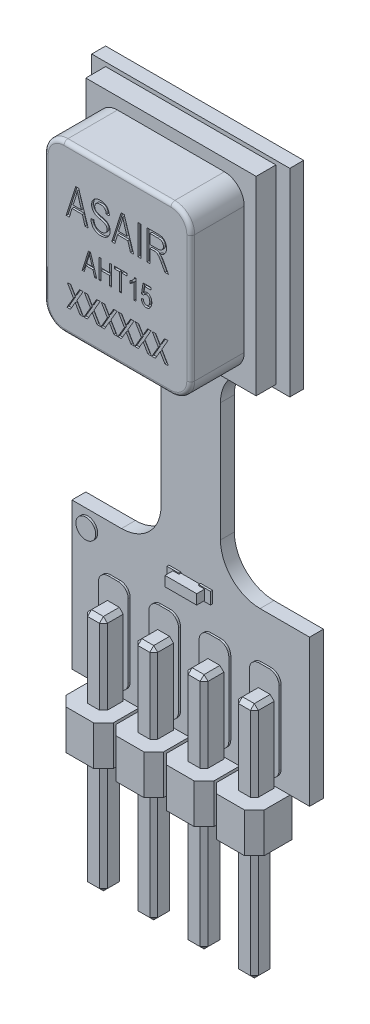
from build123d import *

# Parameters (mm, degrees)
SKETCH1_W                  = 5
SKETCH1_H                  = 5
BOSS_EXTRUDE1_DEPTH        = 0.35
FILLET1_R                  = 1
BOSS_EXTRUDE3_START        = -0.35
SKETCH6_W                  = 3.7
SKETCH6_H                  = 4.2
BOSS_EXTRUDE3_DEPTH        = 2.2
SKETCH3_W                  = 4.3
SKETCH3_H                  = 4.8
BOSS_EXTRUDE2_DEPTH        = 0.5
FILLET2_R                  = 0.5
FILLET3_R                  = 0.1
SKETCH7_R                  = 0.25
SKETCH7_W                  = 0.75
SKETCH7_H                  = 2.35
SKETCH7_W_2                = 0.3
SKETCH7_H_2                = 0.3
BOSS_EXTRUDE4_DEPTH        = 0.05
FILLET4_R                  = 0.25
SKETCH8_W                  = 0.8
SKETCH8_H                  = 0.25
BOSS_EXTRUDE5_DEPTH        = 0.25
SKETCH9_W                  = 1.2
SKETCH9_H                  = 1.2
BOSS_EXTRUDE6_DEPTH        = 1
CHAMFER1_SIZE              = 0.25
SKETCH10_W                 = 0.5
SKETCH10_H                 = 0.5
BOSS_EXTRUDE7_DEPTH        = 3
CHAMFER2_SIZE              = 0.1
LPATTERN1_COUNT            = 4
LPATTERN1_PITCH            = 1.27
CHAMFER1_OF_LPATTERN1_SIZE = 0.25
CHAMFER2_OF_LPATTERN1_SIZE = 0.1
SKETCH11_W                 = 0.077922078
SKETCH11_H                 = 0.75
CUT_EXTRUDE1_DEPTH         = 0.05


with BuildPart() as part:
    # Sketch1 → Boss-Extrude1 (new body)
    with BuildSketch(Plane.XY):
        Rectangle(SKETCH1_W, SKETCH1_H)
        Polygon((0.75, -2.5), (-0.75, -2.5), (-0.75, -7.5), (-3, -7.5), (-3, -11.2), (3, -11.2), (3, -7.5), (0.75, -7.5), align=None)
    extrude(amount=-BOSS_EXTRUDE1_DEPTH)

    # Fillet1
    fillet1_edges = [part.edges().sort_by_distance(p)[0] for p in [
        (0.75, -2.5, -0.175),
        (0.75, -7.5, -0.175),
        (-0.75, -7.5, -0.175),
        (-0.75, -2.5, -0.175),
    ]]
    fillet(fillet1_edges, radius=FILLET1_R)

    # Sketch6 → Boss-Extrude3 (add)
    with BuildSketch(Plane.XY.offset(BOSS_EXTRUDE3_START)):
        Rectangle(SKETCH6_W, SKETCH6_H)
    extrude(amount=BOSS_EXTRUDE3_DEPTH)

    # Sketch3 → Boss-Extrude2 (add)
    with BuildSketch(Plane.XY):
        Rectangle(SKETCH3_W, SKETCH3_H)
    extrude(amount=BOSS_EXTRUDE2_DEPTH)

    # Fillet2
    fillet2_edges = [part.edges().sort_by_distance(p)[0] for p in [
        (1.85, -2.1, 1.175),
        (1.85, 2.1, 1.175),
        (-1.85, 2.1, 1.175),
        (-1.85, -2.1, 1.175),
    ]]
    fillet(fillet2_edges, radius=FILLET2_R)

    # Fillet3
    fillet3_edges = [part.edges().sort_by_distance(p)[0] for p in [
        (0, 2.1, 1.85),
        (1.85, 0, 1.85),
        (-1.85, 0, 1.85),
        (0, -2.1, 1.85),
        (1.703553391, -1.953553391, 1.85),
        (-1.703553391, -1.953553391, 1.85),
        (-1.703553391, 1.953553391, 1.85),
        (1.703553391, 1.953553391, 1.85),
    ]]
    fillet(fillet3_edges, radius=FILLET3_R)

    # Sketch7 → Boss-Extrude4 (add)
    with BuildSketch(Plane.XY):
        with Locations((-2.6, -7.9)):
            Circle(SKETCH7_R)
        with Locations((-1.905, -9.825)):
            Rectangle(SKETCH7_W, SKETCH7_H)
        with Locations((-0.635, -9.825)):
            Rectangle(SKETCH7_W, SKETCH7_H)
        with Locations((0.635, -9.825)):
            Rectangle(SKETCH7_W, SKETCH7_H)
        with Locations((1.905, -9.825)):
            Rectangle(SKETCH7_W, SKETCH7_H)
        with Locations((-0.4, -7.85)):
            Rectangle(SKETCH7_W_2, SKETCH7_H_2)
        with Locations((0.4, -7.85)):
            Rectangle(SKETCH7_W_2, SKETCH7_H_2)
    extrude(amount=BOSS_EXTRUDE4_DEPTH)

    # Fillet4
    fillet4_edges = [part.edges().sort_by_distance(p)[0] for p in [
        (-2.28, -8.65, 0.025),
        (-2.28, -11, 0.025),
        (-1.53, -11, 0.025),
        (-1.53, -8.65, 0.025),
        (-1.01, -8.65, 0.025),
        (-1.01, -11, 0.025),
        (-0.26, -11, 0.025),
        (-0.26, -8.65, 0.025),
        (0.26, -8.65, 0.025),
        (0.26, -11, 0.025),
        (1.01, -11, 0.025),
        (1.01, -8.65, 0.025),
        (1.53, -8.65, 0.025),
        (1.53, -11, 0.025),
        (2.28, -11, 0.025),
        (2.28, -8.65, 0.025),
    ]]
    fillet(fillet4_edges, radius=FILLET4_R)

    # Sketch8 → Boss-Extrude5 (add)
    with BuildSketch(Plane.XY):
        with Locations((0, -7.85)):
            Rectangle(SKETCH8_W, SKETCH8_H)
    extrude(amount=BOSS_EXTRUDE5_DEPTH)

    # Sketch9 → Boss-Extrude6 (add)
    with BuildSketch(Plane.XZ.offset(11.2)):
        with Locations((-1.905, 0.3)):
            Rectangle(SKETCH9_W, SKETCH9_H)
    boss_extrude6 = extrude(amount=BOSS_EXTRUDE6_DEPTH)

    # Chamfer1
    chamfer1_edges = [part.edges().sort_by_distance(p)[0] for p in [
        (-1.305, -11.7, -0.3),
        (-1.305, -11.7, 0.9),
        (-2.505, -11.7, 0.9),
        (-2.505, -11.7, -0.3),
    ]]
    chamfer(chamfer1_edges, length=CHAMFER1_SIZE)

    # Sketch10 → Boss-Extrude7 (add, symmetric)
    with BuildSketch(Plane.XZ.offset(12.2)):
        with Locations((-1.905, 0.3)):
            Rectangle(SKETCH10_W, SKETCH10_H)
    boss_extrude7 = extrude(amount=BOSS_EXTRUDE7_DEPTH, both=True)

    # Chamfer2
    chamfer2_edges = [part.edges().sort_by_distance(p)[0] for p in [
        (-2.155, -9.2, 0.3),
        (-1.655, -9.2, 0.3),
        (-2.155, -10.2, 0.55),
        (-1.905, -9.2, 0.55),
        (-1.655, -10.2, 0.55),
        (-1.905, -15.2, 0.05),
        (-2.155, -13.7, 0.05),
        (-2.155, -15.2, 0.3),
        (-2.155, -13.7, 0.55),
        (-1.905, -15.2, 0.55),
        (-1.655, -13.7, 0.05),
        (-1.655, -15.2, 0.3),
        (-1.655, -13.7, 0.55),
    ]]
    chamfer(chamfer2_edges, length=CHAMFER2_SIZE)

    # LPattern1: Boss-Extrude6, Boss-Extrude7 ×4
    with Locations(*[(i * LPATTERN1_PITCH, 0, 0) for i in range(1, LPATTERN1_COUNT)]):
        add(boss_extrude6)
        add(boss_extrude7)

    # Chamfer1 of LPattern1
    chamfer1_of_lpattern1_edges = [part.edges().sort_by_distance(p)[0] for p in [
        (-0.035, -11.7, -0.3),
        (-0.035, -11.7, 0.9),
        (-1.235, -11.7, 0.9),
        (-1.235, -11.7, -0.3),
        (1.235, -11.7, -0.3),
        (1.235, -11.7, 0.9),
        (0.035, -11.7, 0.9),
        (0.035, -11.7, -0.3),
        (2.505, -11.7, -0.3),
        (2.505, -11.7, 0.9),
        (1.305, -11.7, 0.9),
        (1.305, -11.7, -0.3),
    ]]
    chamfer(chamfer1_of_lpattern1_edges, length=CHAMFER1_OF_LPATTERN1_SIZE)

    # Chamfer2 of LPattern1
    chamfer2_of_lpattern1_edges = [part.edges().sort_by_distance(p)[0] for p in [
        (-0.885, -9.2, 0.3),
        (-0.385, -9.2, 0.3),
        (-0.885, -10.2, 0.55),
        (-0.635, -9.2, 0.55),
        (-0.385, -10.2, 0.55),
        (-0.635, -15.2, 0.05),
        (-0.885, -13.7, 0.05),
        (-0.885, -15.2, 0.3),
        (-0.885, -13.7, 0.55),
        (-0.635, -15.2, 0.55),
        (-0.385, -13.7, 0.05),
        (-0.385, -15.2, 0.3),
        (-0.385, -13.7, 0.55),
        (0.385, -9.2, 0.3),
        (0.885, -9.2, 0.3),
        (0.385, -10.2, 0.55),
        (0.635, -9.2, 0.55),
        (0.885, -10.2, 0.55),
        (0.635, -15.2, 0.05),
        (0.385, -13.7, 0.05),
        (0.385, -15.2, 0.3),
        (0.385, -13.7, 0.55),
        (0.635, -15.2, 0.55),
        (0.885, -13.7, 0.05),
        (0.885, -15.2, 0.3),
        (0.885, -13.7, 0.55),
        (1.655, -9.2, 0.3),
        (2.155, -9.2, 0.3),
        (1.655, -10.2, 0.55),
        (1.905, -9.2, 0.55),
        (2.155, -10.2, 0.55),
        (1.905, -15.2, 0.05),
        (1.655, -13.7, 0.05),
        (1.655, -15.2, 0.3),
        (1.655, -13.7, 0.55),
        (1.905, -15.2, 0.55),
        (2.155, -13.7, 0.05),
        (2.155, -15.2, 0.3),
        (2.155, -13.7, 0.55),
    ]]
    chamfer(chamfer2_of_lpattern1_edges, length=CHAMFER2_OF_LPATTERN1_SIZE)

    # Sketch11 → Cut-Extrude1 (cut)
    # profile 1 of 16: a face of its own
    with BuildSketch(Plane.XY.offset(1.85)):
        Polygon((-1.295454545, 0.5), (-1.055905032, 1.25), (-0.979961445, 1.25), (-0.74025974, 0.5), (-0.821225649, 0.5), (-0.886820211, 0.724025974), (-1.148894075, 0.724025974), (-1.214336445, 0.5), align=None)
        with BuildLine():
            Line((-1.123325893, 0.811688312), (-0.912540584, 0.811688312))
            Line((-0.912540584, 0.811688312), (-0.975243506, 1.017755682))
            add(Edge.make_bspline(
                [(-0.975243506, 1.017755682), (-0.977589239, 1.025463121), (-0.982168938, 1.040510774), (-0.988654211, 1.062545168), (-0.994878599, 1.083444379), (-1.000195426, 1.10335419), (-1.005482376, 1.122015555), (-1.01004201, 1.139636144), (-1.014135042, 1.156128508), (-1.016649337, 1.166799599), (-1.017857143, 1.171925731)],
                knots=[0, 0, 0, 0, 1.20859176, 2.359599242, 3.445754582, 4.479676267, 5.450859039, 6.355343929, 7.209947359, 8, 8, 8, 8], degree=3))
            add(Edge.make_bspline(
                [(-1.017857143, 1.171925731), (-1.020049832, 1.159985574), (-1.024432297, 1.136121124), (-1.032647056, 1.100570601), (-1.041786224, 1.06508423), (-1.049060666, 1.041672614), (-1.05270901, 1.029931006)],
                knots=[0, 0, 0, 0, 0.995500629, 1.989678841, 2.991765375, 4, 4, 4, 4], degree=3))
            Line((-1.05270901, 1.029931006), (-1.123325893, 0.811688312))
        make_face(mode=Mode.SUBTRACT)
    # profile 2 of 16: a face of its own
    with BuildSketch(Plane.XY.offset(1.85)):
        with BuildLine():
            Line((-0.672077922, 0.743506494), (-0.594155844, 0.753246753))
            add(Edge.make_bspline(
                [(-0.594155844, 0.753246753), (-0.593021253, 0.743326643), (-0.590869493, 0.724513076), (-0.584976182, 0.698166299), (-0.57709386, 0.675276365), (-0.567355767, 0.655382138), (-0.55487651, 0.638518567), (-0.540621981, 0.623352604), (-0.523832192, 0.610121597), (-0.505037623, 0.598570848), (-0.484351169, 0.589248453), (-0.462157002, 0.582806942), (-0.438768418, 0.578684173), (-0.422755193, 0.578179863), (-0.414569805, 0.577922078)],
                knots=[0, 0, 0, 0, 1.28056062, 2.428593037, 3.455857635, 4.381585452, 5.257863862, 6.137303782, 7.045121912, 7.991827123, 8.962072888, 9.946560163, 10.950355038, 12, 12, 12, 12], degree=3))
            add(Edge.make_bspline(
                [(-0.414569805, 0.577922078), (-0.408730973, 0.578040733), (-0.397383678, 0.57827133), (-0.380860703, 0.58000575), (-0.365297764, 0.582618449), (-0.35084121, 0.586683045), (-0.337222291, 0.591436168), (-0.324824398, 0.597773005), (-0.31322263, 0.604934546), (-0.302753935, 0.613272481), (-0.293522843, 0.622644048), (-0.285155497, 0.632479486), (-0.27835221, 0.64324687), (-0.272615478, 0.654521653), (-0.268408513, 0.6665814), (-0.265145476, 0.679185969), (-0.263326342, 0.692570896), (-0.263101895, 0.701699364), (-0.262987013, 0.706371753)],
                knots=[0, 0, 0, 0, 1.25000475, 2.42928239, 3.554432982, 4.624373226, 5.641561959, 6.637472043, 7.59895824, 8.557494333, 9.494616268, 10.412591127, 11.316575992, 12.215324116, 13.115580924, 14.045624415, 14.999656403, 16, 16, 16, 16], degree=3))
            add(Edge.make_bspline(
                [(-0.262987013, 0.706371753), (-0.263154527, 0.711760649), (-0.263480803, 0.722256908), (-0.266257952, 0.737536678), (-0.270993128, 0.751696561), (-0.2774394, 0.764844953), (-0.285764905, 0.776876262), (-0.296046641, 0.787731618), (-0.308264036, 0.797327201), (-0.319921777, 0.804604338), (-0.331183347, 0.809904711), (-0.341823047, 0.814473566), (-0.354636629, 0.81929295), (-0.369603332, 0.824480133), (-0.386727896, 0.82988406), (-0.406019757, 0.83567419), (-0.427411483, 0.84192643), (-0.442465169, 0.846055646), (-0.450334821, 0.848214286)],
                knots=[0, 0, 0, 0, 1.005239862, 1.957963033, 2.886140254, 3.783827184, 4.682063204, 5.60636897, 6.563082868, 7.574767638, 8.163399764, 8.884479363, 9.735568196, 10.717712603, 11.840607427, 13.08667948, 14.476996158, 16, 16, 16, 16], degree=3))
            add(Edge.make_bspline(
                [(-0.450334821, 0.848214286), (-0.457397304, 0.850206966), (-0.471007797, 0.854047169), (-0.490525608, 0.860192988), (-0.508504276, 0.866158627), (-0.524832982, 0.872523306), (-0.539716795, 0.878567894), (-0.552862705, 0.885054644), (-0.564472032, 0.891406237), (-0.577823291, 0.899832412), (-0.592406105, 0.91161721), (-0.607861866, 0.927364467), (-0.621363473, 0.94480139), (-0.632628142, 0.963926455), (-0.641764315, 0.984504832), (-0.647814009, 1.006686833), (-0.652033439, 1.030024512), (-0.652407051, 1.046094272), (-0.652597403, 1.054281656)],
                knots=[0, 0, 0, 0, 1.113815205, 2.146493548, 3.105946624, 3.988323839, 4.806360381, 5.543364066, 6.212027532, 6.814445107, 7.937696897, 9.048553401, 10.157540001, 11.276136463, 12.410655589, 13.563606105, 14.758681343, 16, 16, 16, 16], degree=3))
            add(Edge.make_bspline(
                [(-0.652597403, 1.054281656), (-0.652429436, 1.061646785), (-0.652099247, 1.076125144), (-0.649280491, 1.097316089), (-0.644812561, 1.117549158), (-0.638145523, 1.13660825), (-0.629988706, 1.154764805), (-0.619658902, 1.171654392), (-0.607714195, 1.187681756), (-0.593884976, 1.20246595), (-0.578653209, 1.216024606), (-0.561844648, 1.227678337), (-0.543814114, 1.237553722), (-0.524557836, 1.245897531), (-0.503898781, 1.252067296), (-0.482033328, 1.256410162), (-0.458932281, 1.259264), (-0.443089143, 1.259578803), (-0.434963474, 1.25974026)],
                knots=[0, 0, 0, 0, 1.048547399, 2.061232895, 3.039277619, 3.994368589, 4.931972946, 5.868741773, 6.808014961, 7.774272834, 8.746911737, 9.706990873, 10.680354074, 11.670809819, 12.690200298, 13.744432806, 14.843158913, 16, 16, 16, 16], degree=3))
            add(Edge.make_bspline(
                [(-0.434963474, 1.25974026), (-0.423885487, 1.259430988), (-0.402269424, 1.258827519), (-0.370913883, 1.253780462), (-0.341713703, 1.245230123), (-0.314779892, 1.233332177), (-0.290322736, 1.218311838), (-0.268761719, 1.200078017), (-0.249951717, 1.17903851), (-0.234303594, 1.154966941), (-0.221638585, 1.128413671), (-0.212364552, 1.099496203), (-0.206318448, 1.068369803), (-0.205147418, 1.046801422), (-0.204545455, 1.035714286)],
                knots=[0, 0, 0, 0, 1.10297814, 2.152200164, 3.153123011, 4.125894755, 5.076644034, 6.001845166, 6.928824672, 7.877651763, 8.851800581, 9.850539915, 10.895078977, 12, 12, 12, 12], degree=3))
            Line((-0.204545455, 1.035714286), (-0.282467532, 1.025974026))
            add(Edge.make_bspline(
                [(-0.282467532, 1.025974026), (-0.283039152, 1.031971602), (-0.284153853, 1.043667338), (-0.287233789, 1.060492248), (-0.291170336, 1.076179297), (-0.296105759, 1.090642715), (-0.30230742, 1.103828938), (-0.309212202, 1.11588795), (-0.317254755, 1.126695147), (-0.326227792, 1.136309853), (-0.336229808, 1.144729573), (-0.347126921, 1.152109206), (-0.359011779, 1.15835996), (-0.371905515, 1.163342021), (-0.385640319, 1.167350737), (-0.40038334, 1.170016813), (-0.416051806, 1.17172009), (-0.426841934, 1.17195661), (-0.432376218, 1.172077922)],
                knots=[0, 0, 0, 0, 1.225165016, 2.389166377, 3.475498799, 4.513395989, 5.492249234, 6.435697439, 7.335638185, 8.226419293, 9.105162265, 9.989643781, 10.899061877, 11.830466535, 12.797276613, 13.805291738, 14.874328703, 16, 16, 16, 16], degree=3))
            add(Edge.make_bspline(
                [(-0.432376218, 1.172077922), (-0.438013282, 1.17202964), (-0.448908961, 1.171936317), (-0.464755957, 1.170095433), (-0.479595113, 1.167664226), (-0.493446571, 1.163961969), (-0.506190965, 1.159289629), (-0.518005599, 1.153584737), (-0.528730018, 1.146794874), (-0.538422295, 1.138965965), (-0.546910396, 1.130260581), (-0.554377571, 1.121002323), (-0.560763382, 1.111155399), (-0.565740487, 1.100571241), (-0.569715308, 1.08940723), (-0.572636554, 1.077640869), (-0.574300294, 1.065236268), (-0.574548652, 1.056772321), (-0.574675325, 1.052455357)],
                knots=[0, 0, 0, 0, 1.28677749, 2.487165856, 3.639785246, 4.719183444, 5.756778416, 6.736320351, 7.710431992, 8.649732596, 9.575714218, 10.482424581, 11.363216052, 12.249555033, 13.147559346, 14.066626488, 15.013899474, 16, 16, 16, 16], degree=3))
            add(Edge.make_bspline(
                [(-0.574675325, 1.052455357), (-0.574417131, 1.044717166), (-0.573926187, 1.030003354), (-0.569336367, 1.009275799), (-0.561696608, 0.99110791), (-0.553948192, 0.98119165), (-0.550172484, 0.976359578)],
                knots=[0, 0, 0, 0, 1.135097977, 2.158336086, 3.102579849, 4, 4, 4, 4], degree=3))
            add(Edge.make_bspline(
                [(-0.550172484, 0.976359578), (-0.547854185, 0.974047811), (-0.54281896, 0.969026773), (-0.533121289, 0.962700796), (-0.52157773, 0.956045658), (-0.507588488, 0.950009679), (-0.491663402, 0.943680784), (-0.47340039, 0.937878398), (-0.453031081, 0.931874847), (-0.438581344, 0.928309681), (-0.431006494, 0.926440747)],
                knots=[0, 0, 0, 0, 0.600125557, 1.303441474, 2.117395318, 3.047759802, 4.098473224, 5.265768101, 6.566659033, 8, 8, 8, 8], degree=3))
            add(Edge.make_bspline(
                [(-0.431006494, 0.926440747), (-0.423542673, 0.924640107), (-0.409200953, 0.921180182), (-0.388633793, 0.915783972), (-0.369739186, 0.910796092), (-0.352545197, 0.906019104), (-0.337171214, 0.901076451), (-0.323481458, 0.89649405), (-0.311398081, 0.892401966), (-0.3041125, 0.889248115), (-0.300730519, 0.887784091)],
                knots=[0, 0, 0, 0, 1.354590389, 2.602843464, 3.751324185, 4.802492375, 5.750771121, 6.599881396, 7.350062303, 8, 8, 8, 8], degree=3))
            add(Edge.make_bspline(
                [(-0.300730519, 0.887784091), (-0.291606853, 0.88337113), (-0.273917691, 0.874815186), (-0.250337199, 0.858044127), (-0.230141211, 0.838987559), (-0.213707348, 0.817222895), (-0.200736929, 0.793229601), (-0.191651589, 0.766912787), (-0.18602906, 0.738468545), (-0.185392271, 0.71877693), (-0.185064935, 0.708654627)],
                knots=[0, 0, 0, 0, 1.070280572, 2.075083192, 3.046573603, 3.996247495, 4.946860593, 5.919165523, 6.930365132, 8, 8, 8, 8], degree=3))
            add(Edge.make_bspline(
                [(-0.185064935, 0.708654627), (-0.185395943, 0.698482016), (-0.186049983, 0.678381873), (-0.191854958, 0.64898106), (-0.201339692, 0.620962986), (-0.214606263, 0.594782475), (-0.230841666, 0.570678714), (-0.249947207, 0.549296897), (-0.272008134, 0.531159972), (-0.296714771, 0.51618377), (-0.324068876, 0.504300907), (-0.354188067, 0.496293676), (-0.386844248, 0.491109696), (-0.40952622, 0.490549627), (-0.421266234, 0.49025974)],
                knots=[0, 0, 0, 0, 1.011281659, 1.998199493, 2.968653118, 3.946038549, 4.909179922, 5.852720419, 6.788493457, 7.73981833, 8.718701351, 9.744837575, 10.832745308, 12, 12, 12, 12], degree=3))
            add(Edge.make_bspline(
                [(-0.421266234, 0.49025974), (-0.430508846, 0.490453548), (-0.448544595, 0.49083174), (-0.474829116, 0.494088258), (-0.499650434, 0.499386796), (-0.523063834, 0.506853851), (-0.545104578, 0.51647897), (-0.565748525, 0.528218474), (-0.584893208, 0.542153956), (-0.602387884, 0.55818777), (-0.618208996, 0.575977521), (-0.632149902, 0.595374664), (-0.643942283, 0.616425845), (-0.653599289, 0.638959404), (-0.661453682, 0.66293495), (-0.667197171, 0.688406538), (-0.670868562, 0.715453814), (-0.671668461, 0.734008499), (-0.672077922, 0.743506494)],
                knots=[0, 0, 0, 0, 1.104995383, 2.156254069, 3.161771291, 4.136451373, 5.090038804, 6.032932257, 6.970972664, 7.915738022, 8.865457713, 9.813334699, 10.766787024, 11.745048075, 12.740780621, 13.779854267, 14.863525297, 16, 16, 16, 16], degree=3))
        make_face()
    # profile 3 of 16: a face of its own
    with BuildSketch(Plane.XY.offset(1.85)):
        Polygon((-0.146103896, 0.5), (0.093445617, 1.25), (0.169389205, 1.25), (0.409090909, 0.5), (0.328125, 0.5), (0.262530438, 0.724025974), (0.000456575, 0.724025974), (-0.064985795, 0.5), align=None)
        with BuildLine():
            Line((0.026024756, 0.811688312), (0.236810065, 0.811688312))
            Line((0.236810065, 0.811688312), (0.174107143, 1.017755682))
            add(Edge.make_bspline(
                [(0.174107143, 1.017755682), (0.171761411, 1.025463121), (0.167181711, 1.040510774), (0.160696438, 1.062545168), (0.15447205, 1.083444379), (0.149155224, 1.10335419), (0.143868274, 1.122015555), (0.139308639, 1.139636144), (0.135215607, 1.156128508), (0.132701312, 1.166799599), (0.131493506, 1.171925731)],
                knots=[0, 0, 0, 0, 1.20859176, 2.359599242, 3.445754582, 4.479676267, 5.450859039, 6.355343929, 7.209947359, 8, 8, 8, 8], degree=3))
            add(Edge.make_bspline(
                [(0.131493506, 1.171925731), (0.129300817, 1.159985574), (0.124918352, 1.136121124), (0.116703593, 1.100570601), (0.107564425, 1.06508423), (0.100289984, 1.041672614), (0.09664164, 1.029931006)],
                knots=[0, 0, 0, 0, 0.995500629, 1.989678841, 2.991765375, 4, 4, 4, 4], degree=3))
            Line((0.09664164, 1.029931006), (0.026024756, 0.811688312))
        make_face(mode=Mode.SUBTRACT)
    # profile 4 of 16: a face of its own
    with BuildSketch(Plane.XY.offset(1.85)):
        with Locations((0.555194805, 0.875)):
            Rectangle(SKETCH11_W, SKETCH11_H)
    # profile 5 of 16: a face of its own
    with BuildSketch(Plane.XY.offset(1.85)):
        with BuildLine():
            Line((0.74025974, 0.5), (0.74025974, 1.25))
            Line((0.74025974, 1.25), (1.015726461, 1.25))
            add(Edge.make_bspline(
                [(1.015726461, 1.25), (1.022678173, 1.249959985), (1.036133927, 1.249882532), (1.055626537, 1.248768328), (1.073751616, 1.247118954), (1.090485019, 1.244925929), (1.105729059, 1.241885529), (1.11954419, 1.238197306), (1.132042805, 1.234080477), (1.146715705, 1.227289732), (1.163455626, 1.216756612), (1.181509618, 1.200708873), (1.197323443, 1.180835818), (1.211395402, 1.158002463), (1.22295173, 1.132366012), (1.231137594, 1.104407904), (1.236079239, 1.074495475), (1.236696324, 1.053895121), (1.237012987, 1.043323864)],
                knots=[0, 0, 0, 0, 0.957775898, 1.853873864, 2.6892683, 3.465319774, 4.178195347, 4.829309051, 5.435011313, 5.988660553, 7.053440284, 8.147710094, 9.30058322, 10.540256924, 11.835580405, 13.162637032, 14.543981594, 16, 16, 16, 16], degree=3))
            add(Edge.make_bspline(
                [(1.237012987, 1.043323864), (1.236847419, 1.036318562), (1.236524012, 1.022635018), (1.234564899, 1.002579413), (1.231160413, 0.983555617), (1.225953836, 0.965612856), (1.219915483, 0.948528163), (1.211986349, 0.93260102), (1.202889179, 0.917625729), (1.192315685, 0.90372132), (1.180488843, 0.890918798), (1.167215678, 0.879419402), (1.152754274, 0.869059846), (1.136991872, 0.859931092), (1.120026022, 0.85191629), (1.101656044, 0.845520818), (1.082168237, 0.839920136), (1.068612802, 0.837351229), (1.061688312, 0.836038961)],
                knots=[0, 0, 0, 0, 1.121977975, 2.191573688, 3.224240956, 4.211948119, 5.180998842, 6.122125515, 7.055751929, 7.983633331, 8.914994346, 9.842128418, 10.791356962, 11.759862547, 12.75578979, 13.791489111, 14.871831714, 16, 16, 16, 16], degree=3))
            add(Edge.make_bspline(
                [(1.061688312, 0.836038961), (1.06679929, 0.833211181), (1.076528608, 0.827828185), (1.089843535, 0.819143236), (1.101222669, 0.810401407), (1.107655398, 0.804039869), (1.110693994, 0.801034903)],
                knots=[0, 0, 0, 0, 1.158843086, 2.205987482, 3.152571606, 4, 4, 4, 4], degree=3))
            add(Edge.make_bspline(
                [(1.110693994, 0.801034903), (1.116771601, 0.793698986), (1.128995159, 0.778944661), (1.145751711, 0.755405986), (1.161802281, 0.730919179), (1.171227932, 0.713693973), (1.175984172, 0.705002029)],
                knots=[0, 0, 0, 0, 0.982253192, 1.975551771, 2.978451105, 4, 4, 4, 4], degree=3))
            Line((1.175984172, 0.705002029), (1.285714286, 0.5))
            Line((1.285714286, 0.5), (1.197138799, 0.5))
            Line((1.197138799, 0.5), (1.110541802, 0.660409903))
            add(Edge.make_bspline(
                [(1.110541802, 0.660409903), (1.106507721, 0.667931312), (1.098791488, 0.682317972), (1.087339797, 0.702744908), (1.076694648, 0.721166978), (1.066874019, 0.737602149), (1.057732372, 0.751876061), (1.049521842, 0.764184857), (1.042002523, 0.774388366), (1.033003087, 0.784901062), (1.022542706, 0.795798546), (1.010107856, 0.806743036), (0.997687448, 0.815227427), (0.985041771, 0.821688565), (0.971121597, 0.825944972), (0.9554363, 0.829130947), (0.937284267, 0.830863876), (0.924414891, 0.831062878), (0.917562906, 0.831168831)],
                knots=[0, 0, 0, 0, 1.483643366, 2.83785556, 4.070616892, 5.1822306, 6.165666296, 7.016844219, 7.754091418, 8.367230408, 9.421242841, 10.377779407, 11.241203819, 12.029974219, 12.835959019, 13.762973995, 14.808950166, 16, 16, 16, 16], degree=3))
            Line((0.917562906, 0.831168831), (0.818181818, 0.831168831))
            Line((0.818181818, 0.831168831), (0.818181818, 0.5))
            Line((0.818181818, 0.5), (0.74025974, 0.5))
        make_face()
        with BuildLine():
            Line((0.818181818, 0.918831169), (1.00096388, 0.918831169))
            add(Edge.make_bspline(
                [(1.00096388, 0.918831169), (1.010353908, 0.919014087), (1.027951738, 0.919356895), (1.052571097, 0.921633632), (1.073584425, 0.925753667), (1.091384232, 0.931754311), (1.106562359, 0.939705368), (1.119776908, 0.949551505), (1.131367806, 0.961310629), (1.141227104, 0.974912206), (1.14937905, 0.990059202), (1.154880955, 1.006710106), (1.158615428, 1.024387569), (1.158929835, 1.036607083), (1.159090909, 1.042867289)],
                knots=[0, 0, 0, 0, 1.47306528, 2.760668081, 3.873497699, 4.82484281, 5.696997418, 6.550136397, 7.399890849, 8.276969651, 9.17766846, 10.086208714, 11.019541422, 12, 12, 12, 12], degree=3))
            add(Edge.make_bspline(
                [(1.159090909, 1.042867289), (1.158950231, 1.047385257), (1.158675974, 1.056193156), (1.157232995, 1.069060653), (1.154416724, 1.081169319), (1.15070083, 1.092584221), (1.145705026, 1.103201071), (1.139871108, 1.113187459), (1.132523962, 1.122132805), (1.124528553, 1.130601376), (1.115275646, 1.138119533), (1.104942602, 1.144633848), (1.093531504, 1.15010599), (1.081151908, 1.154798126), (1.067552555, 1.157919172), (1.05305216, 1.160622331), (1.037470469, 1.162120993), (1.026737877, 1.162263963), (1.021205357, 1.162337662)],
                knots=[0, 0, 0, 0, 1.045235731, 2.037714497, 2.988326782, 3.915852726, 4.808207886, 5.697550021, 6.58254782, 7.478674216, 8.387536059, 9.331464042, 10.296946822, 11.310355404, 12.385965615, 13.518246496, 14.720686494, 16, 16, 16, 16], degree=3))
            Line((1.021205357, 1.162337662), (0.818181818, 1.162337662))
            Line((0.818181818, 1.162337662), (0.818181818, 0.918831169))
        make_face(mode=Mode.SUBTRACT)
    # profile 6 of 16: a face of its own
    with BuildSketch(Plane.XY.offset(1.85)):
        Polygon((-0.892857143, -0.5), (-0.733157468, 0), (-0.682528409, 0), (-0.522727273, -0.5), (-0.576704545, -0.5), (-0.620434253, -0.350649351), (-0.795150162, -0.350649351), (-0.838778409, -0.5), align=None)
        with BuildLine():
            Line((-0.778104708, -0.292207792), (-0.637581169, -0.292207792))
            Line((-0.637581169, -0.292207792), (-0.679383117, -0.154829545))
            add(Edge.make_bspline(
                [(-0.679383117, -0.154829545), (-0.680946938, -0.149691252), (-0.684000071, -0.139659484), (-0.688323587, -0.124969888), (-0.692473179, -0.111037081), (-0.69601773, -0.097763873), (-0.699542363, -0.085322963), (-0.702582119, -0.073575904), (-0.705310807, -0.062580994), (-0.706987004, -0.055466934), (-0.707792208, -0.052049513)],
                knots=[0, 0, 0, 0, 1.20859176, 2.359599242, 3.445754582, 4.479676267, 5.450859039, 6.355343929, 7.209947359, 8, 8, 8, 8], degree=3))
            add(Edge.make_bspline(
                [(-0.707792208, -0.052049513), (-0.709254001, -0.060009617), (-0.712175644, -0.075919251), (-0.71765215, -0.0996196), (-0.723744929, -0.12327718), (-0.728594556, -0.138884924), (-0.731026786, -0.146712662)],
                knots=[0, 0, 0, 0, 0.995500629, 1.989678841, 2.991765375, 4, 4, 4, 4], degree=3))
            Line((-0.731026786, -0.146712662), (-0.778104708, -0.292207792))
        make_face(mode=Mode.SUBTRACT)
    # profile 7 of 16: a face of its own
    with BuildSketch(Plane.XY.offset(1.85)):
        Polygon((-0.464285714, -0.5), (-0.464285714, 0), (-0.412337662, 0), (-0.412337662, -0.207792208), (-0.198051948, -0.207792208), (-0.198051948, 0), (-0.146103896, 0), (-0.146103896, -0.5), (-0.198051948, -0.5), (-0.198051948, -0.266233766), (-0.412337662, -0.266233766), (-0.412337662, -0.5), align=None)
    # profile 8 of 16: a face of its own
    with BuildSketch(Plane.XY.offset(1.85)):
        Polygon((0.055194805, -0.5), (0.055194805, -0.058441558), (-0.081168831, -0.058441558), (-0.081168831, 0), (0.243506494, 0), (0.243506494, -0.058441558), (0.107142857, -0.058441558), (0.107142857, -0.5), align=None)
    # profile 9 of 16: a face of its own
    with BuildSketch(Plane.XY.offset(1.85)):
        with BuildLine():
            Line((0.470779221, -0.5), (0.418831169, -0.5))
            Line((0.418831169, -0.5), (0.418831169, -0.103896104))
            add(Edge.make_bspline(
                [(0.418831169, -0.103896104), (0.415640849, -0.107568435), (0.409028915, -0.115179338), (0.397550937, -0.126003103), (0.384759999, -0.137164613), (0.370598731, -0.14799522), (0.356169527, -0.15836919), (0.341918006, -0.167493276), (0.32837831, -0.175431919), (0.319295085, -0.179746938), (0.314935065, -0.181818182)],
                knots=[0, 0, 0, 0, 0.892555828, 1.849821039, 2.893015883, 4.008277588, 5.121255548, 6.154629642, 7.114207698, 8, 8, 8, 8], degree=3))
            Line((0.314935065, -0.181818182), (0.314935065, -0.123376623))
            add(Edge.make_bspline(
                [(0.314935065, -0.123376623), (0.321941968, -0.119159602), (0.335895777, -0.110761669), (0.355446888, -0.096213738), (0.373916571, -0.080511637), (0.39075277, -0.063490845), (0.405827737, -0.045944956), (0.418766928, -0.028434138), (0.429376245, -0.01114444), (0.434580455, 0.000748878), (0.437094156, 0.006493506)],
                knots=[0, 0, 0, 0, 1.082272232, 2.155277244, 3.222407096, 4.289527553, 5.32168536, 6.282742408, 7.170542132, 8, 8, 8, 8], degree=3))
            Line((0.437094156, 0.006493506), (0.470779221, 0.006493506))
            Line((0.470779221, 0.006493506), (0.470779221, -0.5))
        make_face()
    # profile 10 of 16: a face of its own
    with BuildSketch(Plane.XY.offset(1.85)):
        with BuildLine():
            Line((0.600649351, -0.363636364), (0.652597403, -0.357142857))
            add(Edge.make_bspline(
                [(0.652597403, -0.357142857), (0.653124674, -0.361107893), (0.654152235, -0.368835059), (0.656440585, -0.379958681), (0.658964616, -0.390381707), (0.662334675, -0.399899376), (0.665753532, -0.408817572), (0.669979958, -0.416807998), (0.674503732, -0.424106942), (0.679644145, -0.430476597), (0.684982375, -0.436207903), (0.690668802, -0.441057087), (0.696554576, -0.445186581), (0.702602592, -0.44865939), (0.708939017, -0.451328145), (0.715492226, -0.453134494), (0.722226301, -0.454297449), (0.726794504, -0.454462295), (0.729099026, -0.454545455)],
                knots=[0, 0, 0, 0, 1.411223046, 2.750228965, 4.006672634, 5.191927097, 6.311278306, 7.373684419, 8.377051755, 9.337097037, 10.257438676, 11.13782359, 11.969011532, 12.792190119, 13.594685164, 14.388253401, 15.186922146, 16, 16, 16, 16], degree=3))
            add(Edge.make_bspline(
                [(0.729099026, -0.454545455), (0.731980974, -0.454451232), (0.737684411, -0.454264765), (0.746065912, -0.452674169), (0.75417558, -0.450163487), (0.761888655, -0.446423405), (0.769363875, -0.441840659), (0.776529748, -0.436205598), (0.783274127, -0.429455981), (0.789772763, -0.42186291), (0.795785718, -0.413411884), (0.800808045, -0.403980073), (0.805175174, -0.393900493), (0.80888709, -0.383104698), (0.811568497, -0.371501289), (0.813451363, -0.359186407), (0.814727481, -0.346143901), (0.814864575, -0.337192036), (0.814935065, -0.332589286)],
                knots=[0, 0, 0, 0, 0.833557162, 1.649627401, 2.46080936, 3.284070299, 4.12358479, 4.995082037, 5.915776015, 6.88098611, 7.885890802, 8.910954604, 9.967600199, 11.063514457, 12.210406555, 13.409466691, 14.668034258, 16, 16, 16, 16], degree=3))
            add(Edge.make_bspline(
                [(0.814935065, -0.332589286), (0.814854661, -0.328291438), (0.814698003, -0.319917628), (0.813555115, -0.307717808), (0.811790374, -0.296240484), (0.809161224, -0.285501879), (0.805657594, -0.275562914), (0.801673017, -0.266253228), (0.796751715, -0.257750513), (0.791057746, -0.25009817), (0.784931095, -0.243174414), (0.778242188, -0.237246188), (0.77125195, -0.232169398), (0.763888952, -0.227882166), (0.756013985, -0.22483032), (0.747857827, -0.22239437), (0.739250934, -0.221116869), (0.733397729, -0.220893124), (0.730418019, -0.220779221)],
                knots=[0, 0, 0, 0, 1.312040837, 2.556345105, 3.737883698, 4.854849349, 5.925960309, 6.952388988, 7.9424386, 8.917239489, 9.860521384, 10.760061641, 11.639947922, 12.495504232, 13.352616949, 14.212152034, 15.089854369, 16, 16, 16, 16], degree=3))
            add(Edge.make_bspline(
                [(0.730418019, -0.220779221), (0.726819942, -0.220935628), (0.719642142, -0.221247645), (0.709042598, -0.223776176), (0.698862338, -0.228008737), (0.689123964, -0.233692509), (0.680063741, -0.240786194), (0.672007333, -0.249347158), (0.664823536, -0.259104632), (0.661026522, -0.266380334), (0.659090909, -0.270089286)],
                knots=[0, 0, 0, 0, 0.943378558, 1.881944462, 2.841095037, 3.827409543, 4.832274565, 5.849176661, 6.903569879, 8, 8, 8, 8], degree=3))
            Line((0.659090909, -0.270089286), (0.607142857, -0.26268263))
            Line((0.607142857, -0.26268263), (0.646103896, -0.006493506))
            Line((0.646103896, -0.006493506), (0.847402597, -0.006493506))
            Line((0.847402597, -0.006493506), (0.847402597, -0.064935065))
            Line((0.847402597, -0.064935065), (0.689630682, -0.064935065))
            Line((0.689630682, -0.064935065), (0.67086039, -0.188413149))
            add(Edge.make_bspline(
                [(0.67086039, -0.188413149), (0.676712464, -0.18542035), (0.688294194, -0.179497356), (0.706722288, -0.173328949), (0.725660631, -0.169522453), (0.738483311, -0.16906237), (0.744926948, -0.168831169)],
                knots=[0, 0, 0, 0, 1.017619267, 2.013951072, 3.001973272, 4, 4, 4, 4], degree=3))
            add(Edge.make_bspline(
                [(0.744926948, -0.168831169), (0.748960113, -0.168973385), (0.75697589, -0.169256033), (0.76875892, -0.171344494), (0.780154229, -0.174687567), (0.79110869, -0.179537619), (0.80162804, -0.185744233), (0.811790998, -0.193259148), (0.821548374, -0.202096201), (0.830692196, -0.212343387), (0.839215033, -0.223616305), (0.846655945, -0.235993407), (0.852971108, -0.249307486), (0.857982226, -0.263622202), (0.862110142, -0.278793146), (0.864897868, -0.294962185), (0.866500637, -0.3120615), (0.86675359, -0.323758713), (0.866883117, -0.329748377)],
                knots=[0, 0, 0, 0, 0.861018809, 1.711245113, 2.547675859, 3.391805506, 4.262674834, 5.151129072, 6.086914488, 7.068866089, 8.080081396, 9.100796714, 10.1476286, 11.221399762, 12.335728169, 13.501851446, 14.720800604, 16, 16, 16, 16], degree=3))
            add(Edge.make_bspline(
                [(0.866883117, -0.329748377), (0.866759613, -0.335704586), (0.866516292, -0.347439291), (0.864790758, -0.364707767), (0.861829122, -0.381317482), (0.857766363, -0.397291616), (0.852626937, -0.412658918), (0.846188461, -0.427350332), (0.838559737, -0.441351098), (0.829909301, -0.454607672), (0.820265844, -0.466705512), (0.809771102, -0.477423878), (0.798344411, -0.486366963), (0.786172627, -0.493777185), (0.773172371, -0.499500046), (0.759363363, -0.503551422), (0.744747192, -0.506054203), (0.734723354, -0.506345039), (0.729606331, -0.506493506)],
                knots=[0, 0, 0, 0, 1.144340564, 2.254537473, 3.330370625, 4.383172833, 5.418849903, 6.440219285, 7.460844228, 8.47914966, 9.47775429, 10.428908251, 11.354479858, 12.258284926, 13.160219244, 14.07516849, 15.0174017, 16, 16, 16, 16], degree=3))
            add(Edge.make_bspline(
                [(0.729606331, -0.506493506), (0.725339368, -0.506371312), (0.716939205, -0.506130752), (0.704590861, -0.504383842), (0.692752414, -0.501440768), (0.68141635, -0.497263921), (0.670632958, -0.491830589), (0.660299303, -0.485316852), (0.650562004, -0.477535927), (0.641308749, -0.468720362), (0.632806346, -0.458821461), (0.625285464, -0.447872116), (0.61865651, -0.436071748), (0.613069716, -0.423322859), (0.608545918, -0.409682978), (0.604886895, -0.395171319), (0.602105621, -0.379749025), (0.601142404, -0.369091668), (0.600649351, -0.363636364)],
                knots=[0, 0, 0, 0, 0.958587677, 1.88712499, 2.795765124, 3.694982091, 4.595578744, 5.504218877, 6.434682167, 7.391400486, 8.372260331, 9.360890354, 10.371359061, 11.409147611, 12.483330096, 13.596558593, 14.769722824, 16, 16, 16, 16], degree=3))
        make_face()
    # profile 11 of 16: a face of its own
    with BuildSketch(Plane.XY.offset(1.85)):
        with BuildLine():
            Line((-1.275974026, -1.5), (-1.11130276, -1.219054383))
            Line((-1.11130276, -1.219054383), (-1.266233766, -0.954545455))
            Line((-1.266233766, -0.954545455), (-1.177049513, -0.954545455))
            Line((-1.177049513, -0.954545455), (-1.102475649, -1.081625406))
            add(Edge.make_bspline(
                [(-1.102475649, -1.081625406), (-1.099189837, -1.087263358), (-1.092846153, -1.098148152), (-1.083416378, -1.113890239), (-1.074882478, -1.128735511), (-1.069256277, -1.138246007), (-1.066558442, -1.142806412)],
                knots=[0, 0, 0, 0, 1.103760353, 2.130951754, 3.103767371, 4, 4, 4, 4], degree=3))
            add(Edge.make_bspline(
                [(-1.066558442, -1.142806412), (-1.060722162, -1.132915298), (-1.049650881, -1.114152092), (-1.038604099, -1.095374452), (-1.033380682, -1.086495536)],
                knots=[0, 0, 0, 0, 1.054309624, 2, 2, 2, 2], degree=3))
            Line((-1.033380682, -1.086495536), (-0.95606737, -0.954545455))
            Line((-0.95606737, -0.954545455), (-0.866883117, -0.954545455))
            Line((-0.866883117, -0.954545455), (-1.021814123, -1.219054383))
            Line((-1.021814123, -1.219054383), (-0.857142857, -1.5))
            Line((-0.857142857, -1.5), (-0.946479302, -1.5))
            Line((-0.946479302, -1.5), (-1.04586039, -1.330458604))
            Line((-1.04586039, -1.330458604), (-1.066558442, -1.295150162))
            Line((-1.066558442, -1.295150162), (-1.186637581, -1.5))
            Line((-1.186637581, -1.5), (-1.275974026, -1.5))
        make_face()
    # profile 12 of 16: a face of its own
    with BuildSketch(Plane.XY.offset(1.85)):
        with BuildLine():
            Line((-0.847402597, -1.5), (-0.682731331, -1.219054383))
            Line((-0.682731331, -1.219054383), (-0.837662338, -0.954545455))
            Line((-0.837662338, -0.954545455), (-0.748478084, -0.954545455))
            Line((-0.748478084, -0.954545455), (-0.673904221, -1.081625406))
            add(Edge.make_bspline(
                [(-0.673904221, -1.081625406), (-0.670618409, -1.087263358), (-0.664274724, -1.098148152), (-0.654844949, -1.113890239), (-0.64631105, -1.128735511), (-0.640684849, -1.138246007), (-0.637987013, -1.142806412)],
                knots=[0, 0, 0, 0, 1.103760353, 2.130951754, 3.103767371, 4, 4, 4, 4], degree=3))
            add(Edge.make_bspline(
                [(-0.637987013, -1.142806412), (-0.632150734, -1.132915298), (-0.621079453, -1.114152092), (-0.610032671, -1.095374452), (-0.604809253, -1.086495536)],
                knots=[0, 0, 0, 0, 1.054309624, 2, 2, 2, 2], degree=3))
            Line((-0.604809253, -1.086495536), (-0.527495942, -0.954545455))
            Line((-0.527495942, -0.954545455), (-0.438311688, -0.954545455))
            Line((-0.438311688, -0.954545455), (-0.593242695, -1.219054383))
            Line((-0.593242695, -1.219054383), (-0.428571429, -1.5))
            Line((-0.428571429, -1.5), (-0.517907873, -1.5))
            Line((-0.517907873, -1.5), (-0.617288961, -1.330458604))
            Line((-0.617288961, -1.330458604), (-0.637987013, -1.295150162))
            Line((-0.637987013, -1.295150162), (-0.758066153, -1.5))
            Line((-0.758066153, -1.5), (-0.847402597, -1.5))
        make_face()
    # profile 13 of 16: a face of its own
    with BuildSketch(Plane.XY.offset(1.85)):
        with BuildLine():
            Line((-0.418831169, -1.5), (-0.254159903, -1.219054383))
            Line((-0.254159903, -1.219054383), (-0.409090909, -0.954545455))
            Line((-0.409090909, -0.954545455), (-0.319906656, -0.954545455))
            Line((-0.319906656, -0.954545455), (-0.245332792, -1.081625406))
            add(Edge.make_bspline(
                [(-0.245332792, -1.081625406), (-0.24204698, -1.087263358), (-0.235703295, -1.098148152), (-0.226273521, -1.113890239), (-0.217739621, -1.128735511), (-0.21211342, -1.138246007), (-0.209415584, -1.142806412)],
                knots=[0, 0, 0, 0, 1.103760353, 2.130951754, 3.103767371, 4, 4, 4, 4], degree=3))
            add(Edge.make_bspline(
                [(-0.209415584, -1.142806412), (-0.203579305, -1.132915298), (-0.192508024, -1.114152092), (-0.181461242, -1.095374452), (-0.176237825, -1.086495536)],
                knots=[0, 0, 0, 0, 1.054309624, 2, 2, 2, 2], degree=3))
            Line((-0.176237825, -1.086495536), (-0.098924513, -0.954545455))
            Line((-0.098924513, -0.954545455), (-0.00974026, -0.954545455))
            Line((-0.00974026, -0.954545455), (-0.164671266, -1.219054383))
            Line((-0.164671266, -1.219054383), (0, -1.5))
            Line((0, -1.5), (-0.089336445, -1.5))
            Line((-0.089336445, -1.5), (-0.188717532, -1.330458604))
            Line((-0.188717532, -1.330458604), (-0.209415584, -1.295150162))
            Line((-0.209415584, -1.295150162), (-0.329494724, -1.5))
            Line((-0.329494724, -1.5), (-0.418831169, -1.5))
        make_face()
    # profile 14 of 16: a face of its own
    with BuildSketch(Plane.XY.offset(1.85)):
        with BuildLine():
            Line((0.00974026, -1.5), (0.174411526, -1.219054383))
            Line((0.174411526, -1.219054383), (0.019480519, -0.954545455))
            Line((0.019480519, -0.954545455), (0.108664773, -0.954545455))
            Line((0.108664773, -0.954545455), (0.183238636, -1.081625406))
            add(Edge.make_bspline(
                [(0.183238636, -1.081625406), (0.186524449, -1.087263358), (0.192868133, -1.098148152), (0.202297908, -1.113890239), (0.210831807, -1.128735511), (0.216458008, -1.138246007), (0.219155844, -1.142806412)],
                knots=[0, 0, 0, 0, 1.103760353, 2.130951754, 3.103767371, 4, 4, 4, 4], degree=3))
            add(Edge.make_bspline(
                [(0.219155844, -1.142806412), (0.224992123, -1.132915298), (0.236063404, -1.114152092), (0.247110186, -1.095374452), (0.252333604, -1.086495536)],
                knots=[0, 0, 0, 0, 1.054309624, 2, 2, 2, 2], degree=3))
            Line((0.252333604, -1.086495536), (0.329646916, -0.954545455))
            Line((0.329646916, -0.954545455), (0.418831169, -0.954545455))
            Line((0.418831169, -0.954545455), (0.263900162, -1.219054383))
            Line((0.263900162, -1.219054383), (0.428571429, -1.5))
            Line((0.428571429, -1.5), (0.339234984, -1.5))
            Line((0.339234984, -1.5), (0.239853896, -1.330458604))
            Line((0.239853896, -1.330458604), (0.219155844, -1.295150162))
            Line((0.219155844, -1.295150162), (0.099076705, -1.5))
            Line((0.099076705, -1.5), (0.00974026, -1.5))
        make_face()
    # profile 15 of 16: a face of its own
    with BuildSketch(Plane.XY.offset(1.85)):
        with BuildLine():
            Line((0.438311688, -1.5), (0.602982955, -1.219054383))
            Line((0.602982955, -1.219054383), (0.448051948, -0.954545455))
            Line((0.448051948, -0.954545455), (0.537236201, -0.954545455))
            Line((0.537236201, -0.954545455), (0.611810065, -1.081625406))
            add(Edge.make_bspline(
                [(0.611810065, -1.081625406), (0.615095877, -1.087263358), (0.621439562, -1.098148152), (0.630869337, -1.113890239), (0.639403236, -1.128735511), (0.645029437, -1.138246007), (0.647727273, -1.142806412)],
                knots=[0, 0, 0, 0, 1.103760353, 2.130951754, 3.103767371, 4, 4, 4, 4], degree=3))
            add(Edge.make_bspline(
                [(0.647727273, -1.142806412), (0.653563552, -1.132915298), (0.664634833, -1.114152092), (0.675681615, -1.095374452), (0.680905032, -1.086495536)],
                knots=[0, 0, 0, 0, 1.054309624, 2, 2, 2, 2], degree=3))
            Line((0.680905032, -1.086495536), (0.758218344, -0.954545455))
            Line((0.758218344, -0.954545455), (0.847402597, -0.954545455))
            Line((0.847402597, -0.954545455), (0.692471591, -1.219054383))
            Line((0.692471591, -1.219054383), (0.857142857, -1.5))
            Line((0.857142857, -1.5), (0.767806412, -1.5))
            Line((0.767806412, -1.5), (0.668425325, -1.330458604))
            Line((0.668425325, -1.330458604), (0.647727273, -1.295150162))
            Line((0.647727273, -1.295150162), (0.527648133, -1.5))
            Line((0.527648133, -1.5), (0.438311688, -1.5))
        make_face()
    # profile 16 of 16: a face of its own
    with BuildSketch(Plane.XY.offset(1.85)):
        with BuildLine():
            Line((0.866883117, -1.5), (1.031554383, -1.219054383))
            Line((1.031554383, -1.219054383), (0.876623377, -0.954545455))
            Line((0.876623377, -0.954545455), (0.96580763, -0.954545455))
            Line((0.96580763, -0.954545455), (1.040381494, -1.081625406))
            add(Edge.make_bspline(
                [(1.040381494, -1.081625406), (1.043667306, -1.087263358), (1.05001099, -1.098148152), (1.059440765, -1.113890239), (1.067974665, -1.128735511), (1.073600866, -1.138246007), (1.076298701, -1.142806412)],
                knots=[0, 0, 0, 0, 1.103760353, 2.130951754, 3.103767371, 4, 4, 4, 4], degree=3))
            add(Edge.make_bspline(
                [(1.076298701, -1.142806412), (1.08213498, -1.132915298), (1.093206262, -1.114152092), (1.104253043, -1.095374452), (1.109476461, -1.086495536)],
                knots=[0, 0, 0, 0, 1.054309624, 2, 2, 2, 2], degree=3))
            Line((1.109476461, -1.086495536), (1.186789773, -0.954545455))
            Line((1.186789773, -0.954545455), (1.275974026, -0.954545455))
            Line((1.275974026, -0.954545455), (1.121043019, -1.219054383))
            Line((1.121043019, -1.219054383), (1.285714286, -1.5))
            Line((1.285714286, -1.5), (1.196377841, -1.5))
            Line((1.196377841, -1.5), (1.096996753, -1.330458604))
            Line((1.096996753, -1.330458604), (1.076298701, -1.295150162))
            Line((1.076298701, -1.295150162), (0.956219562, -1.5))
            Line((0.956219562, -1.5), (0.866883117, -1.5))
        make_face()
    extrude(amount=-CUT_EXTRUDE1_DEPTH, mode=Mode.SUBTRACT)


solid = part.part
